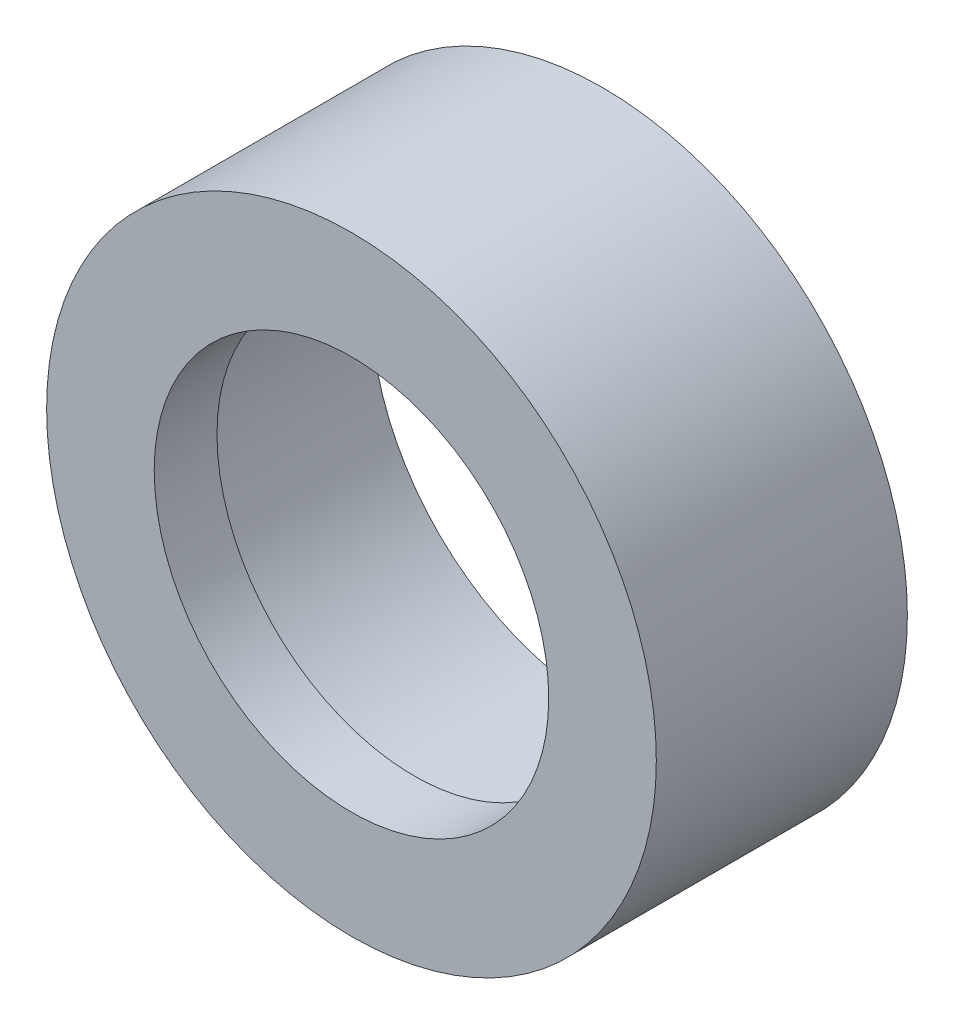
from build123d import *

# Parameters (mm, degrees)
SKETCH1_R           = 17
BOSS_EXTRUDE1_DEPTH = 14
SKETCH2_R           = 12.9
CUT_EXTRUDE1_DEPTH  = 10.5
SKETCH3_R           = 11
CUT_EXTRUDE3_DEPTH  = 28.820855486


with BuildPart() as part:
    # Sketch1 → Boss-Extrude1 (new body)
    with BuildSketch(Plane.XY):
        Circle(SKETCH1_R)
    extrude(amount=BOSS_EXTRUDE1_DEPTH)

    # Sketch2 → Cut-Extrude1 (cut)
    with BuildSketch(Plane.XY):
        with Locations(Location((0, 0, 0), (0, 0, 180))):
            Circle(SKETCH2_R)
    extrude(amount=CUT_EXTRUDE1_DEPTH, mode=Mode.SUBTRACT)

    # Sketch3 → Cut-Extrude3 (cut, through all)
    with BuildSketch(Plane.XY):
        Circle(SKETCH3_R)
    extrude(amount=CUT_EXTRUDE3_DEPTH, mode=Mode.SUBTRACT)


solid = part.part
